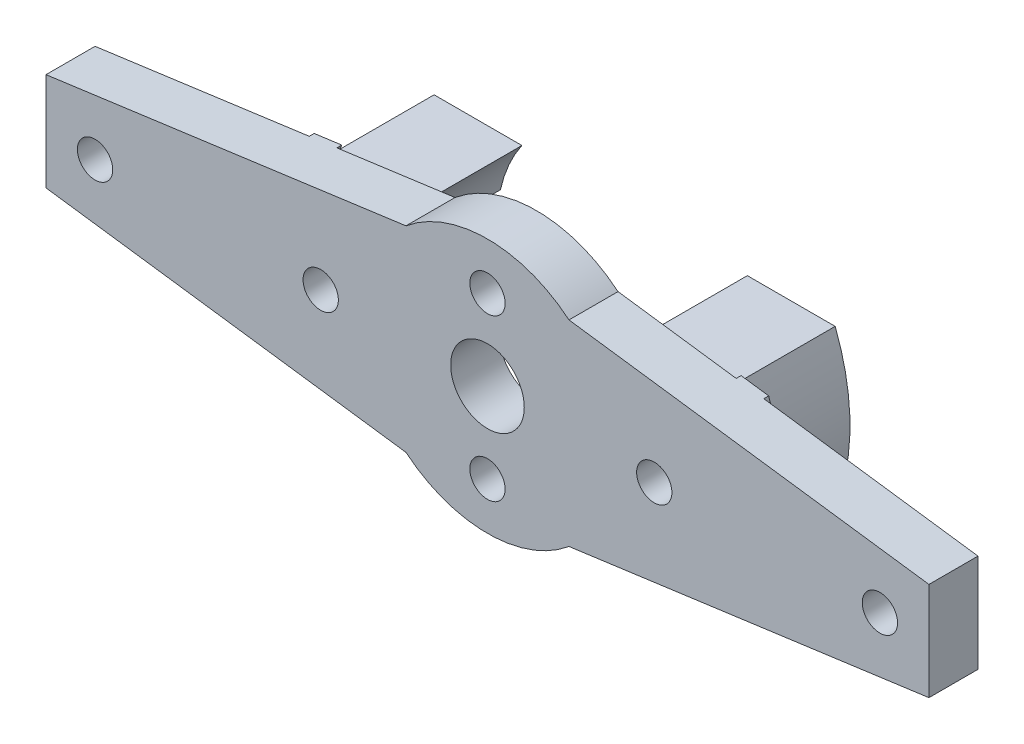
from build123d import *

# Parameters (mm, degrees)
SKETCH_1_W               = 90
SKETCH_1_H               = 20
EXTRUDE_1_DEPTH          = 5
SKETCH_4_R               = 13
SKETCH_4_R_2             = 3.75
SKETCH_4_R_3             = 1.8
EXTRUDE_3_DEPTH          = 5
SKETCH_3_R               = 1.8
CUT_EXTRUDE_1_DEPTH      = 48.106262853
SKETCH_4_3_R             = 3.75
SKETCH_4_3_R_2           = 1.8
CUT_EXTRUDE_3_DEPTH      = 48.106262853
EXTRUDE_4_DEPTH          = 10
SKETCH_8_W               = 46.403712297
SKETCH_8_H               = 9.925238464
SKETCH_8_H_2             = 7.991750451
CUT_EXTRUDE_4_DEPTH      = 10
CUT_EXTRUDE_5_DEPTH      = 10
CUT_EXTRUDE_5_DEPTH_BACK = 50.183330509
CUT_EXTRUDE_6_DEPTH      = 10
EXTRUDE_5_DEPTH          = 0.5


with BuildPart() as part:
    # ｽｹｯﾁ1 → ﾎﾞｽ - 押し出し1 (new body)
    with BuildSketch(Plane.XY):
        Rectangle(SKETCH_1_W, SKETCH_1_H)
    extrude(amount=EXTRUDE_1_DEPTH)

    # ｽｹｯﾁ4 → ﾎﾞｽ - 押し出し3 (add)
    with BuildSketch(Plane.XY.offset(5)):
        Circle(SKETCH_4_R)
        Circle(SKETCH_4_R_2, mode=Mode.SUBTRACT)
        with Locations((0, 8.2)):
            Circle(SKETCH_4_R_3, mode=Mode.SUBTRACT)
        with Locations((0, -8.195848947)):
            Circle(SKETCH_4_R_3, mode=Mode.SUBTRACT)
    extrude(amount=-EXTRUDE_3_DEPTH)

    # ｽｹｯﾁ3 → ｶｯﾄ - 押し出し1 (cut, through all)
    with BuildSketch(Plane.XY.offset(5)):
        with Locations((-40, 0)):
            Circle(SKETCH_3_R)
        with Locations((-17, 0)):
            Circle(SKETCH_3_R)
        with Locations((17, 0)):
            Circle(SKETCH_3_R)
        with Locations((40, 0)):
            Circle(SKETCH_3_R)
    extrude(amount=-CUT_EXTRUDE_1_DEPTH, mode=Mode.SUBTRACT)

    # ｽｹｯﾁ4<3> → ｶｯﾄ - 押し出し3 (cut, through all)
    with BuildSketch(Plane.XY.offset(5)):
        Circle(SKETCH_4_3_R)
        with Locations((0, 8.2)):
            Circle(SKETCH_4_3_R_2)
        with Locations((0, -8.195848947)):
            Circle(SKETCH_4_3_R_2)
    extrude(amount=-CUT_EXTRUDE_3_DEPTH, mode=Mode.SUBTRACT)

    # ｽｹｯﾁ6 → ﾎﾞｽ - 押し出し4 (add)
    with BuildSketch(Plane(origin=(0, 0, 0), x_dir=(-1, 0, 0), z_dir=(0, 0, -1))):
        with BuildLine():
            Line((-19.539767143, 10), (-9.797958971, 10))
            ThreePointArc((-9.797958971, 10), (-14, 0), (-9.797958971, -10))
            Line((-9.797958971, -10), (-19.539767143, -10))
            ThreePointArc((-19.539767143, -10), (-21.95, 0), (-19.539767143, 10))
        make_face()
        with BuildLine():
            Line((9.797958971, 10), (19.539767143, 10))
            ThreePointArc((19.539767143, 10), (21.95, 0), (19.539767143, -10))
            Line((19.539767143, -10), (9.797958971, -10))
            ThreePointArc((9.797958971, -10), (14, 0), (9.797958971, 10))
        make_face()
    extrude(amount=EXTRUDE_4_DEPTH)

    # ｽｹｯﾁ8 → ｶｯﾄ - 押し出し4 (cut)
    with BuildSketch(Plane(origin=(0, 0, -10), x_dir=(-1, 0, 0), z_dir=(0, 0, -1))):
        with Locations((0.837844805, 12.962619232)):
            Rectangle(SKETCH_8_W, SKETCH_8_H)
        with Locations((0.837844805, -11.995875226)):
            Rectangle(SKETCH_8_W, SKETCH_8_H_2)
    extrude(amount=-CUT_EXTRUDE_4_DEPTH, mode=Mode.SUBTRACT)

    # ｽｹｯﾁ9 → ｶｯﾄ - 押し出し5 (cut, two sides: drawn at the far end of the back side and taken through both)
    with BuildSketch(Plane.XY.offset(5).offset(-CUT_EXTRUDE_5_DEPTH_BACK)):
        Polygon((8.306623863, -10), (45, -5), (45, -10), align=None)
        Polygon((45, 5), (8.306623863, 10), (45, 10), align=None)
        Polygon((-8.306623863, 10), (-45, 10), (-45, 5), align=None)
        Polygon((-8.306623863, -10), (-45, -10), (-45, -5), align=None)
    extrude(amount=CUT_EXTRUDE_5_DEPTH + CUT_EXTRUDE_5_DEPTH_BACK, mode=Mode.SUBTRACT)

    # ｽｹｯﾁ12 → ｶｯﾄ - 押し出し6 (cut)
    with BuildSketch(Plane(origin=(0, 0, -10), x_dir=(-1, 0, 0), z_dir=(0, 0, -1))):
        with BuildLine():
            Line((-17.5, 3), (17.5, 3))
            ThreePointArc((17.5, 3), (20.5, 0), (17.5, -3))
            Line((17.5, -3), (-17.5, -3))
            ThreePointArc((-17.5, -3), (-20.5, 0), (-17.5, 3))
        make_face()
    extrude(amount=-CUT_EXTRUDE_6_DEPTH, mode=Mode.SUBTRACT)

    # ｽｹｯﾁ13 → ﾎﾞｽ - 押し出し5 (add)
    with BuildSketch(Plane(origin=(0, 0, 0), x_dir=(-1, 0, 0), z_dir=(0, 0, -1))):
        with BuildLine():
            Line((-20.35015639, 8.358895556), (-23.165607924, 7.97524981))
            ThreePointArc((-23.165607924, 7.97524981), (-24.5, 0), (-23.165607924, -7.97524981))
            Line((-23.165607924, -7.97524981), (-20.35015639, -8.358895556))
            ThreePointArc((-20.35015639, -8.358895556), (-22, 0), (-20.35015639, 8.358895556))
        make_face()
        with BuildLine():
            Line((23.165607924, 7.97524981), (20.35015639, 8.358895556))
            ThreePointArc((20.35015639, 8.358895556), (22, 0), (20.35015639, -8.358895556))
            Line((20.35015639, -8.358895556), (23.165607924, -7.97524981))
            ThreePointArc((23.165607924, -7.97524981), (24.5, 0), (23.165607924, 7.97524981))
        make_face()
    extrude(amount=EXTRUDE_5_DEPTH)


solid = part.part
